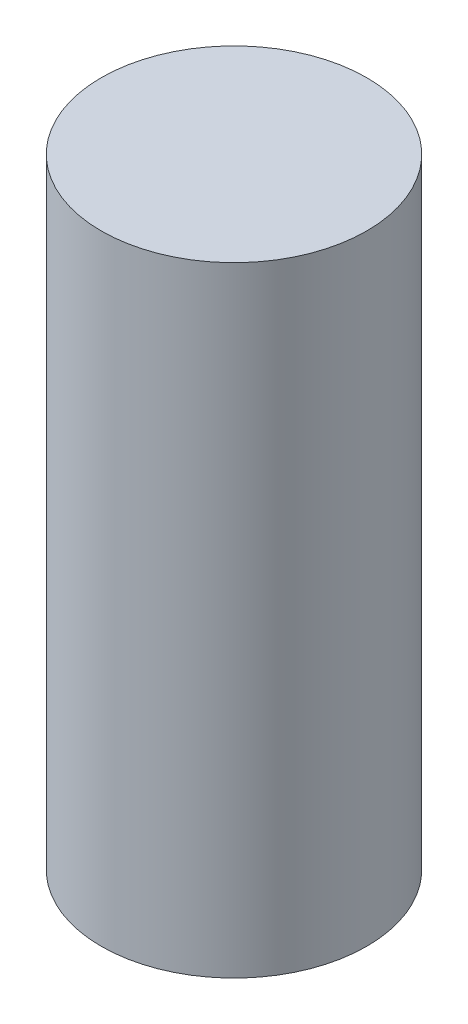
from build123d import *

# Parameters (mm, degrees)
SKETCH1_R           = 7.5
BOSS_EXTRUDE1_DEPTH = 35


with BuildPart() as part:
    # Sketch1 → Boss-Extrude1 (new body)
    with BuildSketch(Plane(origin=(0, 0, 0), x_dir=(1, 0, 0), z_dir=(0, 1, 0))):
        with Locations(Location((0, 0, 0), (0, 0, 270))):
            Circle(SKETCH1_R)
    extrude(amount=BOSS_EXTRUDE1_DEPTH)


solid = part.part
